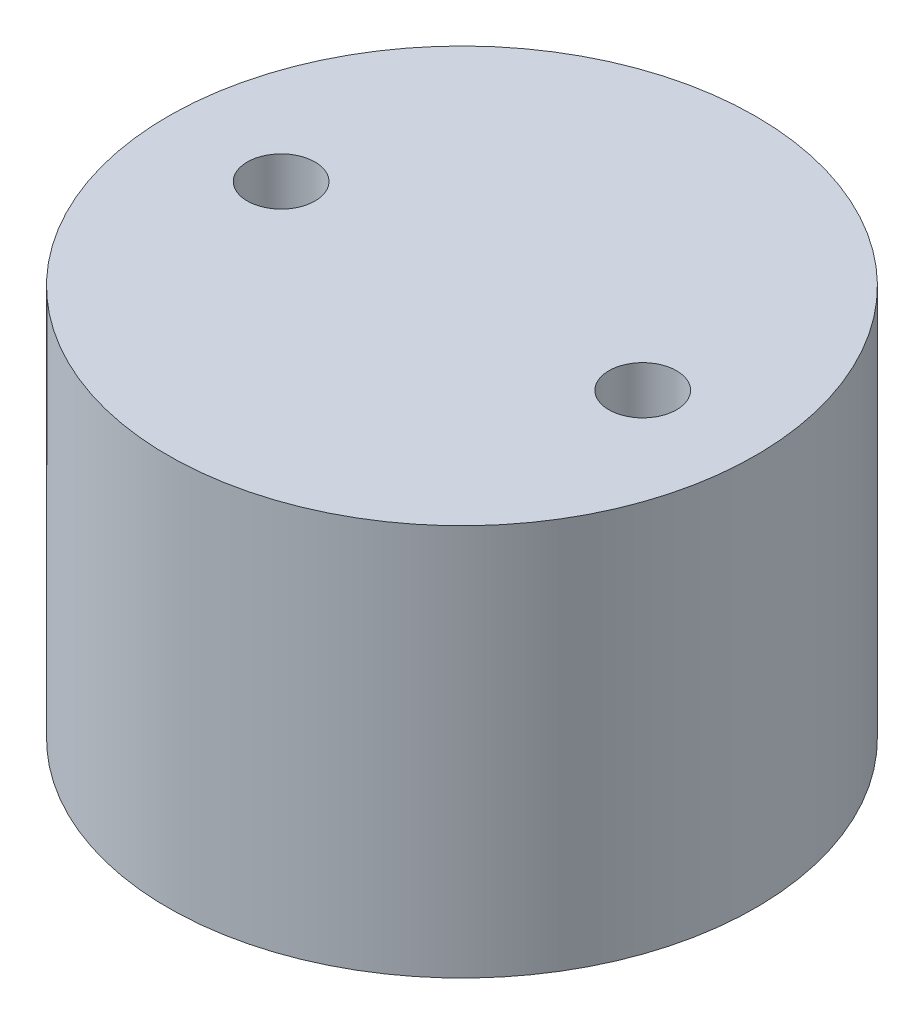
from build123d import *

# Parameters (mm, degrees)
SKETCH1_R                                 = 19.5
BOSS_EXTRUDE1_DEPTH                       = 26
CSK_FOR_8_FLAT_HEAD_MACHINE_SCREW_2_COUNT = 2
CSK_FOR_8_FLAT_HEAD_MACHINE_SCREW_2_PITCH = 24


with BuildPart() as part:
    # Sketch1 → Boss-Extrude1 (new body)
    with BuildSketch(Plane(origin=(0, 0, 0), x_dir=(1, 0, 0), z_dir=(0, 1, 0))):
        with Locations(Location((0, 0, 0), (0, 0, 90))):
            Circle(SKETCH1_R)
    extrude(amount=BOSS_EXTRUDE1_DEPTH)

    # Sketch3 → CSK for #8 Flat Head Machine Screw (100)1 (revolve, cut)
    with BuildSketch(Plane(origin=(12, 0, 0), x_dir=(0, 0, -1), z_dir=(1, 0, 0))):
        Polygon((0, 0), (0, 26), (2.2479, 26), (2.2479, 11.651767624), (4.2164, 10), (4.2164, 0), align=None)
    csk_for_8_flat_head_machine_screw_100 = revolve(axis=Axis((12, -6.35, 0), (0, 1, 0)), mode=Mode.SUBTRACT)

    # CSK for _8 Flat Head Machine Screw _ 2: CSK for #8 Flat Head Machine Screw (100)1 ×2
    with Locations(*[(-i * CSK_FOR_8_FLAT_HEAD_MACHINE_SCREW_2_PITCH, 0, 0) for i in range(1, CSK_FOR_8_FLAT_HEAD_MACHINE_SCREW_2_COUNT)]):
        add(csk_for_8_flat_head_machine_screw_100, mode=Mode.SUBTRACT)


solid = part.part
